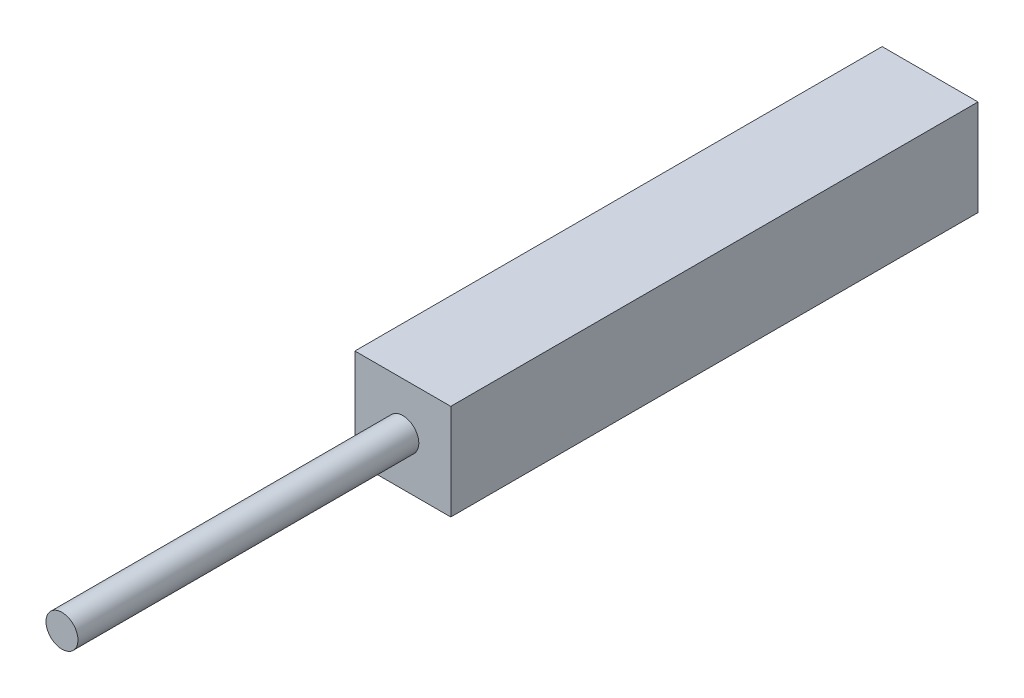
from build123d import *

# Parameters (mm, degrees)
SKETCH_1_W      = 18
SKETCH_1_H      = 18
EXTRUDE_1_DEPTH = 99
SKETCH_2_R      = 3
EXTRUDE_2_DEPTH = 64


with BuildPart() as part:
    # 草图1 → 凸台-拉伸1 (new body)
    with BuildSketch(Plane.XY):
        Rectangle(SKETCH_1_W, SKETCH_1_H)
    extrude(amount=EXTRUDE_1_DEPTH)

    # 草图2 → 凸台-拉伸2 (add)
    with BuildSketch(Plane.XY.offset(99)):
        with Locations(Location((0, 0, 0), (0, 0, 180))):
            Circle(SKETCH_2_R)
    extrude(amount=EXTRUDE_2_DEPTH)


solid = part.part
